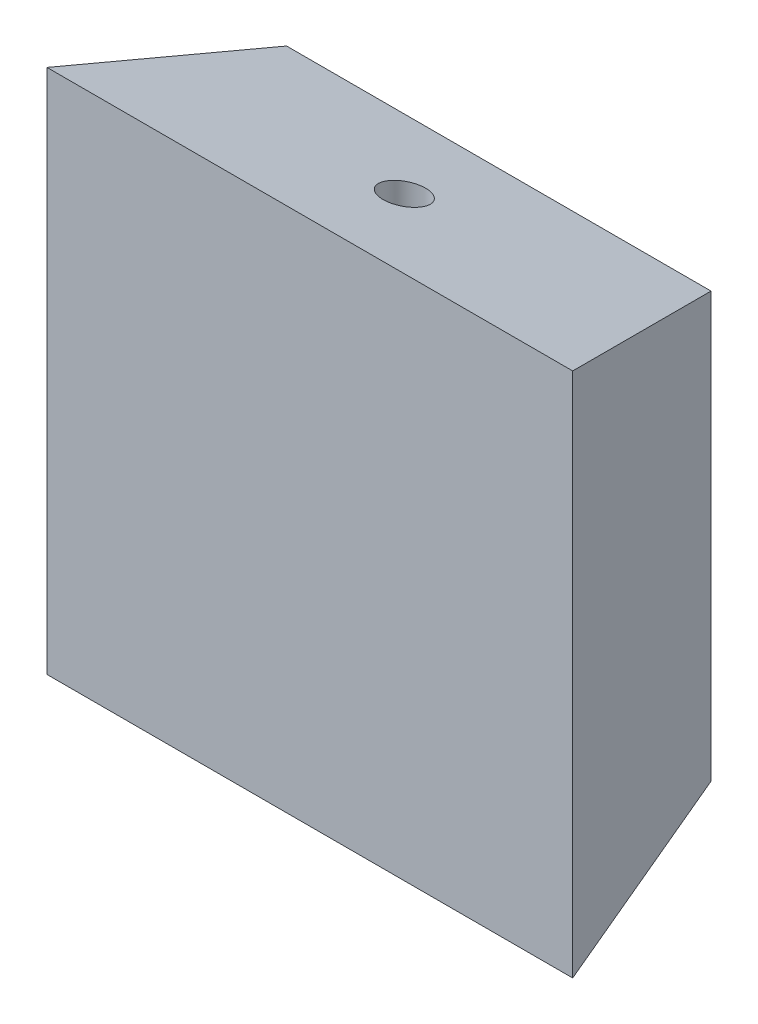
from build123d import *

# Parameters (mm, degrees)
ESQUISSE1_W             = 33.274
ESQUISSE1_H             = 33.274
BOSS_EXTRU_1_DEPTH      = 14.81582
BOSS_EXTRU_1_DRAFT      = -15
ENL_V_MAT_EXTRU_1_DEPTH = 12.7


with BuildPart() as part:
    # Esquisse1 → Boss.-Extru.1 (with draft: the straight prism first)
    with BuildSketch(Plane.XY):
        Rectangle(ESQUISSE1_W, ESQUISSE1_H)
    extrude(amount=BOSS_EXTRU_1_DEPTH)
    # Boss.-Extru.1: the draft: its side faces are tilted about the plane it starts from
    boss_extru_1_sides = [part.faces().sort_by_distance(p)[0] for p in [
        (0, -16.637, 7.40791),
        (16.637, 0, 7.40791),
        (0, 16.637, 7.40791),
        (-16.637, 0, 7.40791),
    ]]
    draft(boss_extru_1_sides, Plane.XY, BOSS_EXTRU_1_DRAFT)

    # Esquisse2 → Enlèv. mat.-Extru.1 (cut)
    with BuildSketch(Plane(origin=(0, 20.32, 0), x_dir=(1, 0, 0), z_dir=(0, 1, 0))):
        with BuildLine():
            ThreePointArc((0, -5.741035), (-1.178658616, -8.586568616), (1.666875, -7.40791))
            ThreePointArc((1.666875, -7.40791), (1.178658616, -6.229251384), (0, -5.741035))
        make_face()
    extrude(amount=-ENL_V_MAT_EXTRU_1_DEPTH, mode=Mode.SUBTRACT)


solid = part.part
